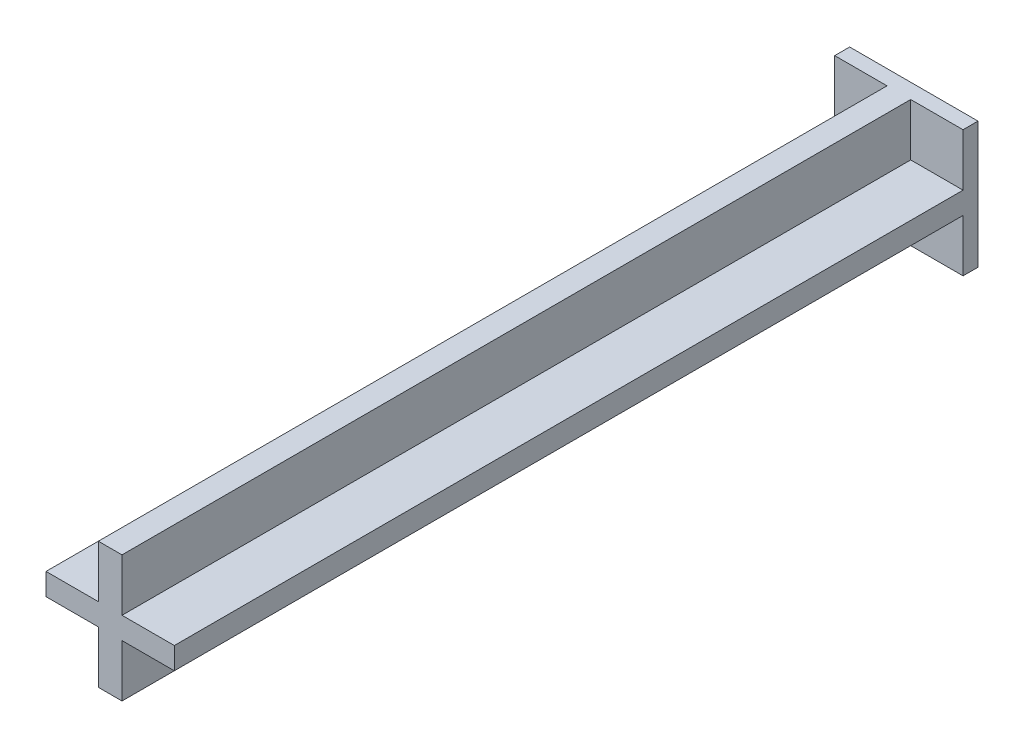
from build123d import *

# Parameters (mm, degrees)
SKETCH1_W           = 218
SKETCH1_H           = 215
BOSS_EXTRUDE1_DEPTH = 1365
SKETCH2_W           = 88.9
SKETCH2_H           = 88.9
CUT_EXTRUDE1_DEPTH  = 1339.6


with BuildPart() as part:
    # Sketch1 → Boss-Extrude1 (new body)
    with BuildSketch(Plane.XY):
        Rectangle(SKETCH1_W, SKETCH1_H)
    extrude(amount=BOSS_EXTRUDE1_DEPTH)

    # Sketch2 → Cut-Extrude1 (cut)
    with BuildSketch(Plane.XY.offset(1365)):
        with Locations((64.55, 63.05)):
            Rectangle(SKETCH2_W, SKETCH2_H)
        with Locations((-64.55, 63.05)):
            Rectangle(SKETCH2_W, SKETCH2_H)
        with Locations((64.55, -63.05)):
            Rectangle(SKETCH2_W, SKETCH2_H)
        with Locations((-64.55, -63.05)):
            Rectangle(SKETCH2_W, SKETCH2_H)
    extrude(amount=-CUT_EXTRUDE1_DEPTH, mode=Mode.SUBTRACT)


solid = part.part
